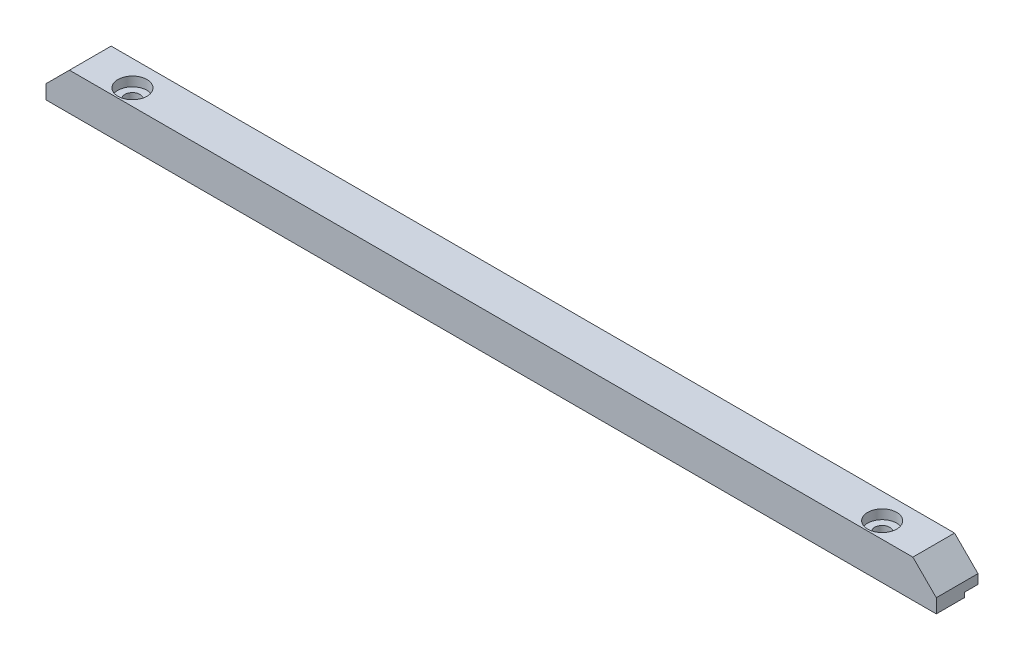
from build123d import *

# Parameters (mm, degrees)
SKETCH_1_W              = 337.35
SKETCH_1_H              = 116.87
SKETCH_1_W_2            = 324.05
SKETCH_1_H_2            = 103.07
EXTRUDE_1_DEPTH         = 8
FILLET_1_R              = 5
HOLE_WIZARD_3_2_3_2_1_D = 3.2
SKETCH_5_W              = 32
SKETCH_5_H              = 1.5
CUT_EXTRUDE_1_DEPTH     = 355.911853
EXTRUDE_2_REACH         = 356.912
SKETCH_6_W              = 3
SKETCH_6_H              = 8
SKETCH_7_W              = 257.05
SKETCH_7_H              = 8
EXTRUDE_3_DEPTH         = 4
SKETCH_8_W              = 257.05
SKETCH_8_H              = 4
EXTRUDE_4_DEPTH         = 3
SKETCH_11_W             = 99.07
SKETCH_11_H             = 11
EXTRUDE_5_DEPTH         = 2
SKETCH_13_W             = 42
SKETCH_13_H             = 4.5
CUT_EXTRUDE_2_DEPTH     = 354.692894189
SKETCH_14_W             = 121.5
SKETCH_14_H             = 1.5
CUT_EXTRUDE_3_DEPTH     = 355.911853
SKETCH_16_W             = 32
SKETCH_16_H             = 6.5
EXTRUDE_7_DEPTH         = 4
SKETCH_17_W             = 103.07
SKETCH_17_H             = 3
CUT_EXTRUDE_4_DEPTH     = 0.1
EXTRUDE_8_DEPTH         = 2
SKETCH_19_W             = 70.55
SKETCH_19_H             = 2
SKETCH_19_W_2           = 95
EXTRUDE_9_DEPTH         = 3
SKETCH_20_R             = 3.5
CUT_EXTRUDE_5_DEPTH     = 4
SKETCH_21_R             = 3.1
CUT_EXTRUDE_6_DEPTH     = 2
EXTRUDE_10_DEPTH        = 2
EXTRUDE_10_DEPTH_BACK   = 3
SKETCH_22_W             = 6
SKETCH_22_H             = 6
SKETCH_22_R             = 1.5
SKETCH_23_W             = 10
SKETCH_23_H             = 1.5
SKETCH_23_W_2           = 15
CUT_EXTRUDE_7_DEPTH     = 6.9
SKETCH_24_W             = 103.07
SKETCH_24_H             = 3
CUT_EXTRUDE_8_DEPTH     = 358.110094229
SKETCH_25_W             = 402.768513644
SKETCH_25_H             = 192.082702388
SKETCH_25_W_2           = 190
SKETCH_25_H_2           = 48.964424343
CUT_EXTRUDE_9_DEPTH     = 358.110094229
CHAMFER_1_SIZE          = 5
SKETCH_26_W             = 121.5
SKETCH_26_H             = 8.9
EXTRUDE_11_DEPTH        = 1.5


with BuildPart() as part:
    # 草图1 → 凸台-拉伸1 (new body)
    with BuildSketch(Plane(origin=(0, 0, 0), x_dir=(1, 0, 0), z_dir=(0, 1, 0))):
        with Locations((168.675, 58.435)):
            Rectangle(SKETCH_1_W, SKETCH_1_H)
        with Locations((168.925, 58.435)):
            Rectangle(SKETCH_1_W_2, SKETCH_1_H_2, mode=Mode.SUBTRACT)
    extrude(amount=EXTRUDE_1_DEPTH)

    # 圆角1
    fillet_1_edges = [part.edges().sort_by_distance(p)[0] for p in [
        (0, 4, -116.87),
        (337.35, 4, -116.87),
        (337.35, 4, 0),
        (0, 4, 0),
    ]]
    fillet(fillet_1_edges, radius=FILLET_1_R)

    # Ø3.2 (3.2) 直径孔1 (through all)
    with Locations(Plane(origin=(0, 8, 0), x_dir=(1, 0, 0), z_dir=(0, 1, 0))):
        with Locations((3.45, 98.435), (87.17, 113.42), (247.17, 113.42), (334.15, 98.435), (334.15, 18.435), (247.17, 3.45), (87.17, 3.45), (3.45, 18.435)):
            Hole(HOLE_WIZARD_3_2_3_2_1_D / 2)

    # 草图5 → 切除-拉伸1 (cut, through all)
    with BuildSketch(Plane.XY.offset(-109.97)):
        with Locations((57.9, 0.75)):
            Rectangle(SKETCH_5_W, SKETCH_5_H)
    extrude(amount=-CUT_EXTRUDE_1_DEPTH, mode=Mode.SUBTRACT)

    # 草图6 → 凸台-拉伸2 (add, up to next)
    with BuildSketch(Plane.XY.offset(-109.97), mode=Mode.PRIVATE) as extrude_2_sk1:
        with Locations((40.4, 4)):
            Rectangle(SKETCH_6_W, SKETCH_6_H)
    extrude_2_tool1 = extrude(extrude_2_sk1.sketch, amount=EXTRUDE_2_REACH, mode=Mode.PRIVATE) - part.part
    add(extrude_2_tool1.solids().sort_by_distance((40.4, 4, -109.97))[0])

    # 草图7 → 凸台-拉伸3 (add)
    with BuildSketch(Plane.XY.offset(-109.97)):
        with Locations((202.425, 4)):
            Rectangle(SKETCH_7_W, SKETCH_7_H)
    extrude(amount=EXTRUDE_3_DEPTH)

    # 草图8 → 凸台-拉伸4 (add)
    with BuildSketch(Plane.XZ):
        with Locations((202.425, -107.97)):
            Rectangle(SKETCH_8_W, SKETCH_8_H)
    extrude(amount=EXTRUDE_4_DEPTH)

    # 草图11 → 凸台-拉伸5 (add)
    with BuildSketch(Plane.ZY.offset(-330.95)):
        with Locations((-56.435, 2.5)):
            Rectangle(SKETCH_11_W, SKETCH_11_H)
    extrude(amount=EXTRUDE_5_DEPTH)

    # 草图13 → 切除-拉伸2 (cut, through all)
    with BuildSketch(Plane.XY.offset(-105.97)):
        with Locations((307.95, -0.75)):
            Rectangle(SKETCH_13_W, SKETCH_13_H)
    extrude(amount=-CUT_EXTRUDE_2_DEPTH, mode=Mode.SUBTRACT)

    # 草图14 → 切除-拉伸3 (cut, through all)
    with BuildSketch(Plane(origin=(0, 0, -6.9), x_dir=(-1, 0, 0), z_dir=(0, 0, -1))):
        with Locations((-173.2, 0.75)):
            Rectangle(SKETCH_14_W, SKETCH_14_H)
    extrude(amount=-CUT_EXTRUDE_3_DEPTH, mode=Mode.SUBTRACT)

    # 草图16 → 凸台-拉伸7 (add)
    with BuildSketch(Plane.XY.offset(-109.97)):
        with Locations((57.9, 4.75)):
            Rectangle(SKETCH_16_W, SKETCH_16_H)
    extrude(amount=EXTRUDE_7_DEPTH)

    # 草图17 → 切除-拉伸4 (cut)
    with BuildSketch(Plane(origin=(330.95, 0, 0), x_dir=(0, 0, -1), z_dir=(1, 0, 0))):
        with Locations((58.435, -1.5)):
            Rectangle(SKETCH_17_W, SKETCH_17_H)
    extrude(amount=-CUT_EXTRUDE_4_DEPTH, mode=Mode.SUBTRACT)

    # 草图18 → 凸台-拉伸8 (add)
    with BuildSketch(Plane(origin=(0, 0, -6.9), x_dir=(-1, 0, 0), z_dir=(0, 0, -1))):
        Polygon((-233.95, 0), (-233.95, 1.5), (-112.45, 1.5), (-112.45, 0), (-41.9, 0), (-41.9, 8), (-328.95, 8), (-328.95, 0), align=None)
    extrude(amount=EXTRUDE_8_DEPTH)

    # 草图19 → 凸台-拉伸9 (add)
    with BuildSketch(Plane.XZ):
        with Locations((77.175, -7.9)):
            Rectangle(SKETCH_19_W, SKETCH_19_H)
        with Locations((281.45, -7.9)):
            Rectangle(SKETCH_19_W_2, SKETCH_19_H)
    extrude(amount=EXTRUDE_9_DEPTH)

    # 草图20 → 切除-拉伸5 (cut)
    with BuildSketch(Plane.XZ.offset(3)):
        with Locations((92.088456012, -9.54)):
            Circle(SKETCH_20_R)
        with Locations((262.268456012, -9.54)):
            Circle(SKETCH_20_R)
        with Locations((328.308456012, -13.35)):
            Circle(SKETCH_20_R)
        with Locations((328.308456012, -74.31)):
            Circle(SKETCH_20_R)
        with Locations((137.808456012, -107.33)):
            Circle(SKETCH_20_R)
        with Locations((22.238456012, -9.54)):
            Circle(SKETCH_20_R)
        with Locations((9.538456012, -23.51)):
            Circle(SKETCH_20_R)
        with Locations((9.538456012, -103.52)):
            Circle(SKETCH_20_R)
    extrude(amount=-CUT_EXTRUDE_5_DEPTH, mode=Mode.SUBTRACT)

    # 草图21 → 切除-拉伸6 (cut)
    with BuildSketch(Plane(origin=(0, 8, 0), x_dir=(1, 0, 0), z_dir=(0, 1, 0))):
        with Locations(Location((87.17, 113.42, 0), (0, 0, 270))):
            Circle(SKETCH_21_R)
        with Locations(Location((247.17, 113.42, 0), (0, 0, 270))):
            Circle(SKETCH_21_R)
        with Locations(Location((334.15, 98.435, 0), (0, 0, 270))):
            Circle(SKETCH_21_R)
        with Locations(Location((334.15, 18.435, 0), (0, 0, 270))):
            Circle(SKETCH_21_R)
        with Locations(Location((247.17, 3.45, 0), (0, 0, 270))):
            Circle(SKETCH_21_R)
        with Locations(Location((87.17, 3.45, 0), (0, 0, 270))):
            Circle(SKETCH_21_R)
        with Locations(Location((3.45, 18.435, 0), (0, 0, 270))):
            Circle(SKETCH_21_R)
        with Locations(Location((3.45, 98.435, 0), (0, 0, 270))):
            Circle(SKETCH_21_R)
    extrude(amount=-CUT_EXTRUDE_6_DEPTH, mode=Mode.SUBTRACT)

    # 草图22 → 凸台-拉伸10 (add, two sides: drawn at the far end of the back side and taken through both)
    # profile 1 of 4: a face of its own
    with BuildSketch(Plane(origin=(0, 4, 0), x_dir=(1, 0, 0), z_dir=(0, 1, 0)).offset(-EXTRUDE_10_DEPTH_BACK)):
        with Locations((9.9, 106.97)):
            Rectangle(SKETCH_22_W, SKETCH_22_H)
        with Locations(Location((9.9, 106.97, 0), (0, 0, 90))):
            Circle(SKETCH_22_R, mode=Mode.SUBTRACT)
    # profile 2 of 4: a face of its own
    with BuildSketch(Plane(origin=(0, 4, 0), x_dir=(1, 0, 0), z_dir=(0, 1, 0)).offset(-EXTRUDE_10_DEPTH_BACK)):
        with Locations((35.9, 106.97)):
            Rectangle(SKETCH_22_W, SKETCH_22_H)
        with Locations(Location((35.9, 106.97, 0), (0, 0, 90))):
            Circle(SKETCH_22_R, mode=Mode.SUBTRACT)
    # profile 3 of 4: a face of its own
    with BuildSketch(Plane(origin=(0, 4, 0), x_dir=(1, 0, 0), z_dir=(0, 1, 0)).offset(-EXTRUDE_10_DEPTH_BACK)):
        with Locations((9.9, 9.9)):
            Rectangle(SKETCH_22_W, SKETCH_22_H)
        with Locations(Location((9.9, 9.9, 0), (0, 0, 90))):
            Circle(SKETCH_22_R, mode=Mode.SUBTRACT)
    # profile 4 of 4: a face of its own
    with BuildSketch(Plane(origin=(0, 4, 0), x_dir=(1, 0, 0), z_dir=(0, 1, 0)).offset(-EXTRUDE_10_DEPTH_BACK)):
        with Locations((35.9, 9.9)):
            Rectangle(SKETCH_22_W, SKETCH_22_H)
        with Locations(Location((35.9, 9.9, 0), (0, 0, 90))):
            Circle(SKETCH_22_R, mode=Mode.SUBTRACT)
    extrude(amount=EXTRUDE_10_DEPTH + EXTRUDE_10_DEPTH_BACK)

    # 草图23 → 切除-拉伸7 (cut)
    with BuildSketch(Plane.ZY):
        with Locations((-63.435, 0.75)):
            Rectangle(SKETCH_23_W, SKETCH_23_H)
        with Locations((-50.935, 0.75)):
            Rectangle(SKETCH_23_W_2, SKETCH_23_H)
    extrude(amount=-CUT_EXTRUDE_7_DEPTH, mode=Mode.SUBTRACT)

    # 草图24 → 切除-拉伸8 (cut, through all)
    with BuildSketch(Plane(origin=(337.35, 0, 0), x_dir=(0, 0, -1), z_dir=(1, 0, 0))):
        with Locations((58.435, -1.5)):
            Rectangle(SKETCH_24_W, SKETCH_24_H)
    extrude(amount=-CUT_EXTRUDE_8_DEPTH, mode=Mode.SUBTRACT)

    # 草图25 → 切除-拉伸9 (cut, through all)
    with BuildSketch(Plane(origin=(0, 8, 0), x_dir=(1, 0, 0), z_dir=(0, 1, 0))):
        with Locations((167.276381716, 50.966242561)):
            Rectangle(SKETCH_25_W, SKETCH_25_H)
        with Locations((167.17, 6.206921893)):
            Rectangle(SKETCH_25_W_2, SKETCH_25_H_2, mode=Mode.SUBTRACT)
    extrude(amount=-CUT_EXTRUDE_9_DEPTH, mode=Mode.SUBTRACT)

    # 倒角1
    chamfer_1_edges = [part.edges().sort_by_distance(p)[0] for p in [
        (72.17, 8, -4.45),
        (262.17, 8, -4.45),
    ]]
    chamfer(chamfer_1_edges, length=CHAMFER_1_SIZE)

    # 草图26 → 凸台-拉伸11 (add)
    with BuildSketch(Plane.XZ.offset(-1.5)):
        with Locations((173.2, -4.45)):
            Rectangle(SKETCH_26_W, SKETCH_26_H)
    extrude(amount=EXTRUDE_11_DEPTH)


solid = part.part
